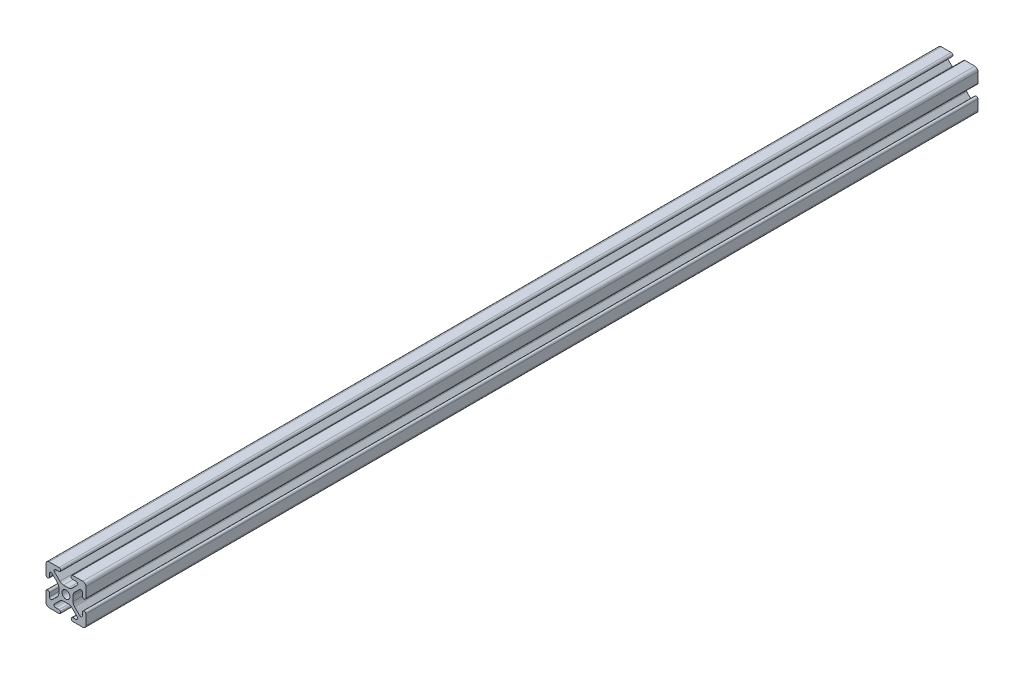
from build123d import *

# Parameters (mm, degrees)
SKETCH1_R      = 2.5
EXTRUDE1_DEPTH = 559.6


with BuildPart() as part:
    # Sketch1 → Extrude1 (new body)
    with BuildSketch(Plane.XY):
        with BuildLine():
            Line((-8.636346088, 7.111588351), (-5.432204773, 3.912143135))
            ThreePointArc((-5.432204773, 3.912143135), (-4.708985779, 2.831057106), (-4.455, 1.555406707))
            Line((-4.455, 1.555406707), (-4.455, -1.555406707))
            ThreePointArc((-4.455, -1.555406707), (-4.708985779, -2.831057106), (-5.432204773, -3.912143135))
            Line((-5.432204773, -3.912143135), (-8.636346088, -7.111588351))
            ThreePointArc((-8.636346088, -7.111588351), (-9.736852394, -7.329863489), (-10.36, -6.396886949))
            Line((-10.36, -6.396886949), (-10.36, -4.32))
            ThreePointArc((-10.36, -4.32), (-11.43, -3.25), (-12.5, -4.32))
            Line((-12.5, -4.32), (-12.5, -8.651801989))
            Line((-12.5, -8.651801989), (-12.5, -10.537068835))
            ThreePointArc((-12.5, -10.537068835), (-11.925070773, -11.925070773), (-10.537068835, -12.5))
            Line((-10.537068835, -12.5), (-8.441567612, -12.5))
            Line((-8.441567612, -12.5), (-4.387856959, -12.5))
            ThreePointArc((-4.387856959, -12.5), (-3.317856959, -11.43), (-4.387856959, -10.36))
            Line((-4.387856959, -10.36), (-6.42, -10.36))
            ThreePointArc((-6.42, -10.36), (-7.35325999, -9.736168088), (-7.133653912, -8.635298598))
            Line((-7.133653912, -8.635298598), (-3.795290766, -5.301828272))
            ThreePointArc((-3.795290766, -5.301828272), (-2.76743922, -4.61585726), (-1.555406707, -4.375))
            Line((-1.555406707, -4.375), (1.555406707, -4.375))
            ThreePointArc((1.555406707, -4.375), (2.76743922, -4.61585726), (3.795290766, -5.301828272))
            Line((3.795290766, -5.301828272), (7.133653912, -8.635298598))
            ThreePointArc((7.133653912, -8.635298598), (7.35325999, -9.736168088), (6.42, -10.36))
            Line((6.42, -10.36), (4.387856959, -10.36))
            ThreePointArc((4.387856959, -10.36), (3.317856959, -11.43), (4.387856959, -12.5))
            Line((4.387856959, -12.5), (8.441567612, -12.5))
            Line((8.441567612, -12.5), (10.537068835, -12.5))
            ThreePointArc((10.537068835, -12.5), (11.925070773, -11.925070773), (12.5, -10.537068835))
            Line((12.5, -10.537068835), (12.5, -8.651801989))
            Line((12.5, -8.651801989), (12.5, -4.32))
            ThreePointArc((12.5, -4.32), (11.43, -3.25), (10.36, -4.32))
            Line((10.36, -4.32), (10.36, -6.396886949))
            ThreePointArc((10.36, -6.396886949), (9.736852394, -7.329863489), (8.636346088, -7.111588351))
            Line((8.636346088, -7.111588351), (5.432204773, -3.912143135))
            ThreePointArc((5.432204773, -3.912143135), (4.708985779, -2.831057106), (4.455, -1.555406707))
            Line((4.455, -1.555406707), (4.455, 1.555406707))
            ThreePointArc((4.455, 1.555406707), (4.708985779, 2.831057106), (5.432204773, 3.912143135))
            Line((5.432204773, 3.912143135), (8.636346088, 7.111588351))
            ThreePointArc((8.636346088, 7.111588351), (9.736852394, 7.329863489), (10.36, 6.396886949))
            Line((10.36, 6.396886949), (10.36, 4.32))
            ThreePointArc((10.36, 4.32), (11.43, 3.25), (12.5, 4.32))
            Line((12.5, 4.32), (12.5, 7.99129648))
            Line((12.5, 7.99129648), (12.5, 10.537068835))
            ThreePointArc((12.5, 10.537068835), (11.925070773, 11.925070773), (10.537068835, 12.5))
            Line((10.537068835, 12.5), (4.32, 12.5))
            ThreePointArc((4.32, 12.5), (3.25, 11.43), (4.32, 10.36))
            Line((4.32, 10.36), (6.42, 10.36))
            ThreePointArc((6.42, 10.36), (7.35325999, 9.736168088), (7.133653912, 8.635298598))
            Line((7.133653912, 8.635298598), (3.795290766, 5.301828272))
            ThreePointArc((3.795290766, 5.301828272), (2.76743922, 4.61585726), (1.555406707, 4.375))
            Line((1.555406707, 4.375), (-1.555406707, 4.375))
            ThreePointArc((-1.555406707, 4.375), (-2.76743922, 4.61585726), (-3.795290766, 5.301828272))
            Line((-3.795290766, 5.301828272), (-7.133653912, 8.635298598))
            ThreePointArc((-7.133653912, 8.635298598), (-7.35325999, 9.736168088), (-6.42, 10.36))
            Line((-6.42, 10.36), (-4.32, 10.36))
            ThreePointArc((-4.32, 10.36), (-3.25, 11.43), (-4.32, 12.5))
            Line((-4.32, 12.5), (-10.537068835, 12.5))
            ThreePointArc((-10.537068835, 12.5), (-11.925070773, 11.925070773), (-12.5, 10.537068835))
            Line((-12.5, 10.537068835), (-12.5, 7.99129648))
            Line((-12.5, 7.99129648), (-12.5, 4.32))
            ThreePointArc((-12.5, 4.32), (-11.43, 3.25), (-10.36, 4.32))
            Line((-10.36, 4.32), (-10.36, 6.396886949))
            ThreePointArc((-10.36, 6.396886949), (-9.736852394, 7.329863489), (-8.636346088, 7.111588351))
        make_face()
        Circle(SKETCH1_R, mode=Mode.SUBTRACT)
    extrude(amount=-EXTRUDE1_DEPTH)


solid = part.part
